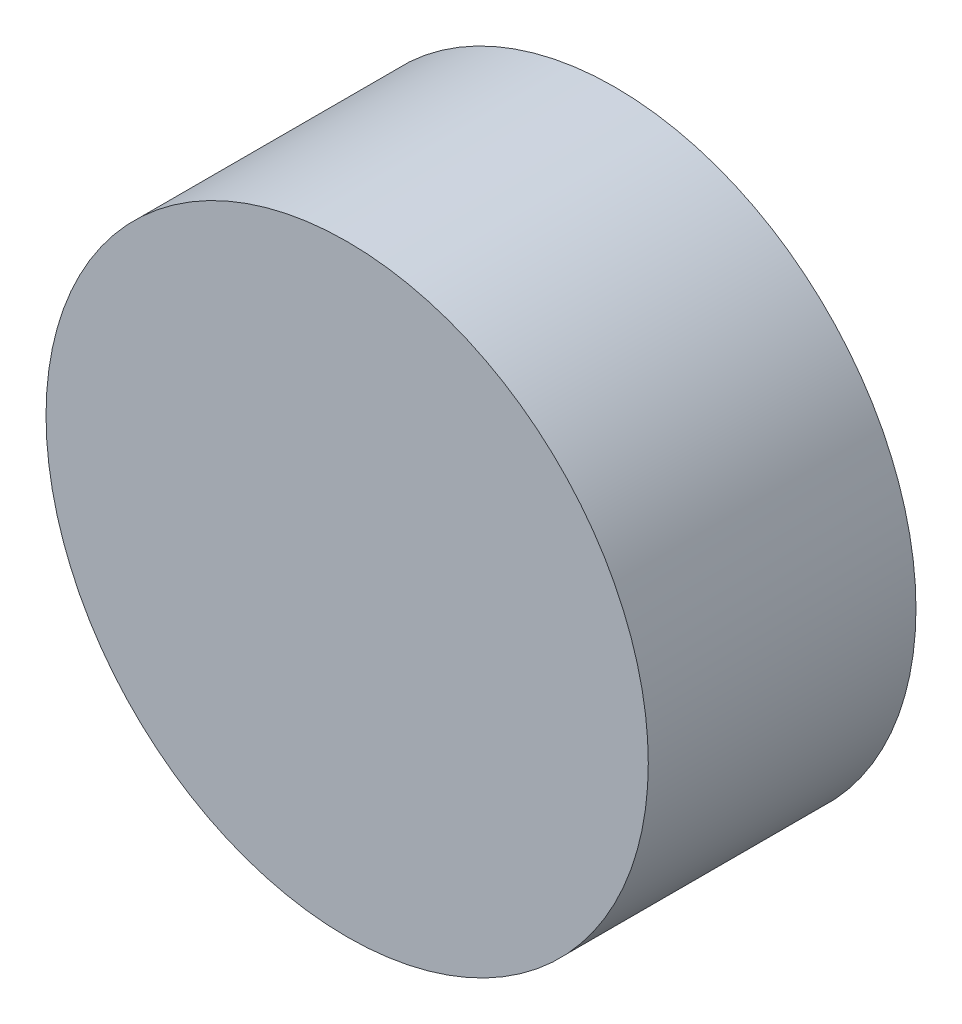
from build123d import *

# Parameters (mm, degrees)
SKETCH1_R           = 45
BOSS_EXTRUDE1_DEPTH = 40


with BuildPart() as part:
    # Sketch1 → Boss-Extrude1 (new body)
    with BuildSketch(Plane.XY):
        Circle(SKETCH1_R)
    extrude(amount=BOSS_EXTRUDE1_DEPTH)


solid = part.part
